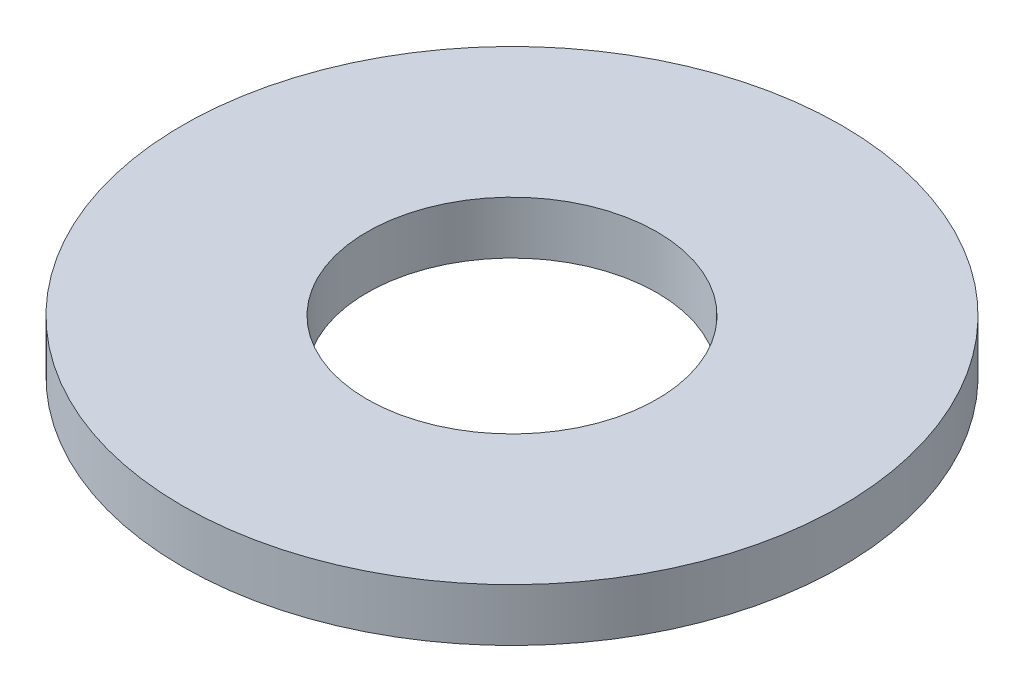
from build123d import *

# Parameters (mm, degrees)
SKETCH1_R           = 2.5
BOSS_EXTRUDE1_DEPTH = 0.4
SKETCH5_R           = 1.1
CUT_EXTRUDE1_DEPTH  = 4.558089375


with BuildPart() as part:
    # Sketch1 → Boss-Extrude1 (new body)
    with BuildSketch(Plane(origin=(0, 0, 0), x_dir=(1, 0, 0), z_dir=(0, 1, 0))):
        with Locations(Location((0, 0, 0), (0, 0, 270))):
            Circle(SKETCH1_R)
    extrude(amount=BOSS_EXTRUDE1_DEPTH)

    # Sketch5 → Cut-Extrude1 (cut, through all)
    with BuildSketch(Plane(origin=(0, 0.4, 0), x_dir=(-1, 0, 0), z_dir=(0, 1, 0))):
        with Locations(Location((0, 0, 0), (0, 0, 90))):
            Circle(SKETCH5_R)
    extrude(amount=-CUT_EXTRUDE1_DEPTH, mode=Mode.SUBTRACT)


solid = part.part
